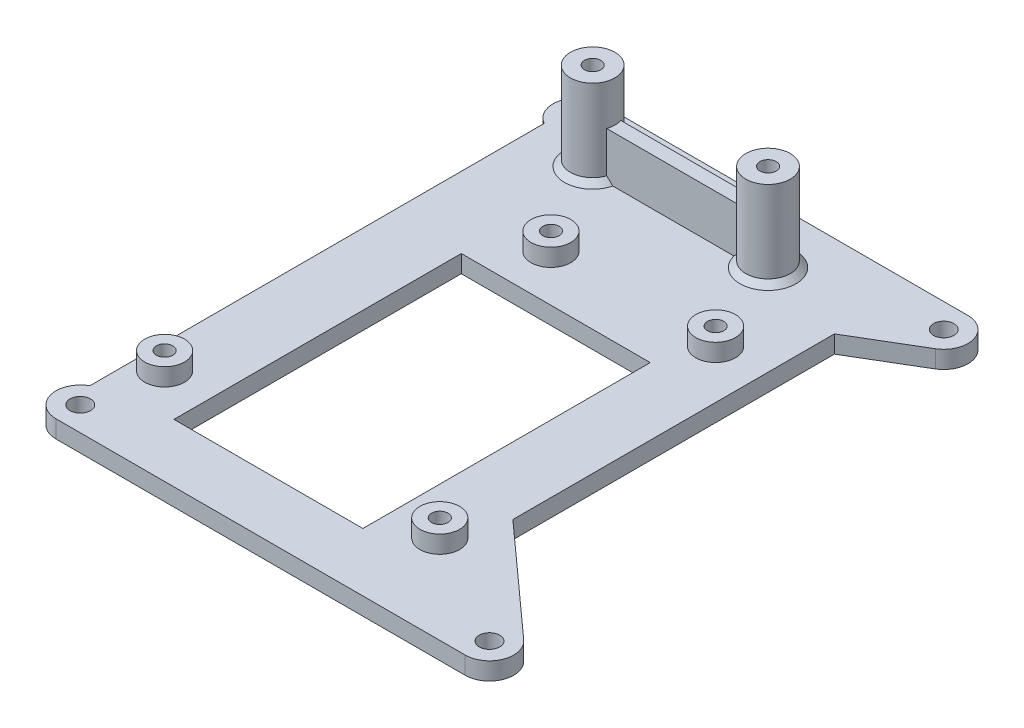
from build123d import *

# Parameters (mm, degrees)
SCHIZZO1_R                   = 1.4
SCHIZZO1_R_2                 = 1.75
ESTRUSIONE_ESTRUSIONE1_DEPTH = 3
SCHIZZO2_R                   = 3.4
SCHIZZO2_R_2                 = 1.4
ESTRUSIONE_ESTRUSIONE2_DEPTH = 3
SCHIZZO3_R                   = 3.8
ESTRUSIONE_ESTRUSIONE3_DEPTH = 15
FORO_2_8_2_8_1_D             = 2.8
FORO_2_8_2_8_1_DEPTH         = 10
SCHIZZO6_W                   = 22.78889745
SCHIZZO6_H                   = 2.4
ESTRUSIONE_ESTRUSIONE4_DEPTH = 8
SMUSSO1_SIZE                 = 1
SCHIZZO8_W                   = 32.32
SCHIZZO8_H                   = 49.15
TAGLIO_ESTRUSIONE1_DEPTH     = 117.922816422


with BuildPart() as part:
    # Schizzo1 → Estrusione-Estrusione1 (new body)
    with BuildSketch(Plane(origin=(0, 0, 0), x_dir=(1, 0, 0), z_dir=(0, 1, 0))):
        with BuildLine():
            Line((-72, 3.636275567), (-72, 81.363724433))
            ThreePointArc((-72, 81.363724433), (-74.019517608, 86.032462202), (-70, 89.15))
            Line((-70, 89.15), (-7.3, 89.15))
            ThreePointArc((-7.3, 89.15), (-3.298340724, 86.09964678), (-5.179319645, 81.432758092))
            Line((-5.179319645, 81.432758092), (-16, 75))
            Line((-16, 75), (-16, 20))
            Line((-16, 20), (2.777722531, 3.083303025))
            ThreePointArc((2.777722531, 3.083303025), (3.87415846, -1.48774871), (0, -4.15))
            Line((0, -4.15), (-70, -4.15))
            ThreePointArc((-70, -4.15), (-74.019517608, -1.032462202), (-72, 3.636275567))
        make_face()
        with Locations(Location((-67.82, 12.25, 0), (0, 0, 270))):
            Circle(SCHIZZO1_R, mode=Mode.SUBTRACT)
        with Locations(Location((-19.5, 11, 0), (0, 0, 270))):
            Circle(SCHIZZO1_R, mode=Mode.SUBTRACT)
        with Locations(Location((-24.32, 63, 0), (0, 0, 270))):
            Circle(SCHIZZO1_R, mode=Mode.SUBTRACT)
        with Locations(Location((-52.49, 63, 0), (0, 0, 270))):
            Circle(SCHIZZO1_R, mode=Mode.SUBTRACT)
        with Locations(Location((0, 0, 0), (0, 0, 270))):
            Circle(SCHIZZO1_R_2, mode=Mode.SUBTRACT)
        with Locations(Location((-70, 0, 0), (0, 0, 270))):
            Circle(SCHIZZO1_R_2, mode=Mode.SUBTRACT)
        with Locations(Location((-70, 85, 0), (0, 0, 270))):
            Circle(SCHIZZO1_R_2, mode=Mode.SUBTRACT)
        with Locations(Location((-7.3, 85, 0), (0, 0, 270))):
            Circle(SCHIZZO1_R_2, mode=Mode.SUBTRACT)
    extrude(amount=ESTRUSIONE_ESTRUSIONE1_DEPTH)

    # Schizzo2 → Estrusione-Estrusione2 (add)
    # profile 1 of 4: a face of its own
    with BuildSketch(Plane(origin=(0, 3, 0), x_dir=(1, 0, 0), z_dir=(0, 1, 0))):
        with Locations(Location((-67.82, 12.25, 0), (0, 0, 270))):
            Circle(SCHIZZO2_R)
        with Locations(Location((-67.82, 12.25, 0), (0, 0, 270))):
            Circle(SCHIZZO2_R_2, mode=Mode.SUBTRACT)
    # profile 2 of 4: a face of its own
    with BuildSketch(Plane(origin=(0, 3, 0), x_dir=(1, 0, 0), z_dir=(0, 1, 0))):
        with Locations(Location((-19.5, 11, 0), (0, 0, 270))):
            Circle(SCHIZZO2_R)
        with Locations(Location((-19.5, 11, 0), (0, 0, 270))):
            Circle(SCHIZZO2_R_2, mode=Mode.SUBTRACT)
    # profile 3 of 4: a face of its own
    with BuildSketch(Plane(origin=(0, 3, 0), x_dir=(1, 0, 0), z_dir=(0, 1, 0))):
        with Locations(Location((-24.32, 63, 0), (0, 0, 270))):
            Circle(SCHIZZO2_R)
        with Locations(Location((-24.32, 63, 0), (0, 0, 270))):
            Circle(SCHIZZO2_R_2, mode=Mode.SUBTRACT)
    # profile 4 of 4: a face of its own
    with BuildSketch(Plane(origin=(0, 3, 0), x_dir=(1, 0, 0), z_dir=(0, 1, 0))):
        with Locations(Location((-52.49, 63, 0), (0, 0, 270))):
            Circle(SCHIZZO2_R)
        with Locations(Location((-52.49, 63, 0), (0, 0, 270))):
            Circle(SCHIZZO2_R_2, mode=Mode.SUBTRACT)
    extrude(amount=ESTRUSIONE_ESTRUSIONE2_DEPTH)

    # Schizzo3 → Estrusione-Estrusione3 (add)
    with BuildSketch(Plane(origin=(0, 3, 0), x_dir=(1, 0, 0), z_dir=(0, 1, 0))):
        with Locations(Location((-61.5, 79.15, 0), (0, 0, 270))):
            Circle(SCHIZZO3_R)
        with Locations(Location((-31.5, 79.15, 0), (0, 0, 270))):
            Circle(SCHIZZO3_R)
    extrude(amount=ESTRUSIONE_ESTRUSIONE3_DEPTH)

    # Foro Ø2.8 (2.8)-1
    with Locations(Plane(origin=(0, 18, 0), x_dir=(1, 0, 0), z_dir=(0, 1, 0))):
        with Locations((-61.5, 79.15), (-31.5, 79.15)):
            Hole(FORO_2_8_2_8_1_D / 2, depth=FORO_2_8_2_8_1_DEPTH)

    # Schizzo6 → Estrusione-Estrusione4 (add)
    with BuildSketch(Plane(origin=(0, 3, 0), x_dir=(1, 0, 0), z_dir=(0, 1, 0))):
        with Locations((-46.5, 79.15)):
            Rectangle(SCHIZZO6_W, SCHIZZO6_H)
    extrude(amount=ESTRUSIONE_ESTRUSIONE4_DEPTH)

    # Smusso1
    smusso1_edges = [part.edges().sort_by_distance(p)[0] for p in [
        (-28.417792999, 3, -81.372611077),
        (-64.582207001, 3, -81.372611077),
    ]]
    chamfer(smusso1_edges, length=SMUSSO1_SIZE)

    # Schizzo8 → Taglio-Estrusione1 (cut, through all)
    with BuildSketch(Plane(origin=(0, 3, 0), x_dir=(1, 0, 0), z_dir=(0, 1, 0))):
        with Locations((-43.66, 30.425)):
            Rectangle(SCHIZZO8_W, SCHIZZO8_H)
    extrude(amount=-TAGLIO_ESTRUSIONE1_DEPTH, mode=Mode.SUBTRACT)


solid = part.part
